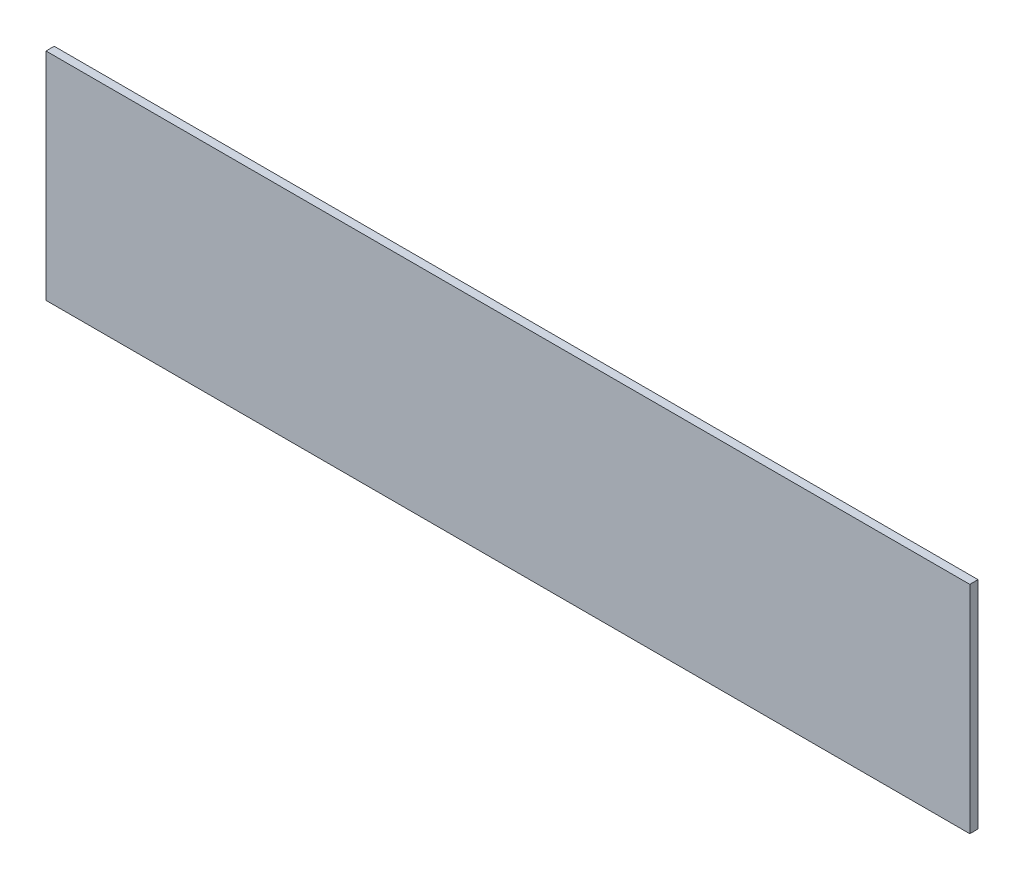
from build123d import *

# Parameters (mm, degrees)
SKETCH1_W           = 357.5499999
SKETCH1_H           = 83.6
BOSS_EXTRUDE1_DEPTH = 3.175


with BuildPart() as part:
    # Sketch1 → Boss-Extrude1 (new body)
    with BuildSketch(Plane.XY):
        Rectangle(SKETCH1_W, SKETCH1_H)
    extrude(amount=BOSS_EXTRUDE1_DEPTH)


solid = part.part
